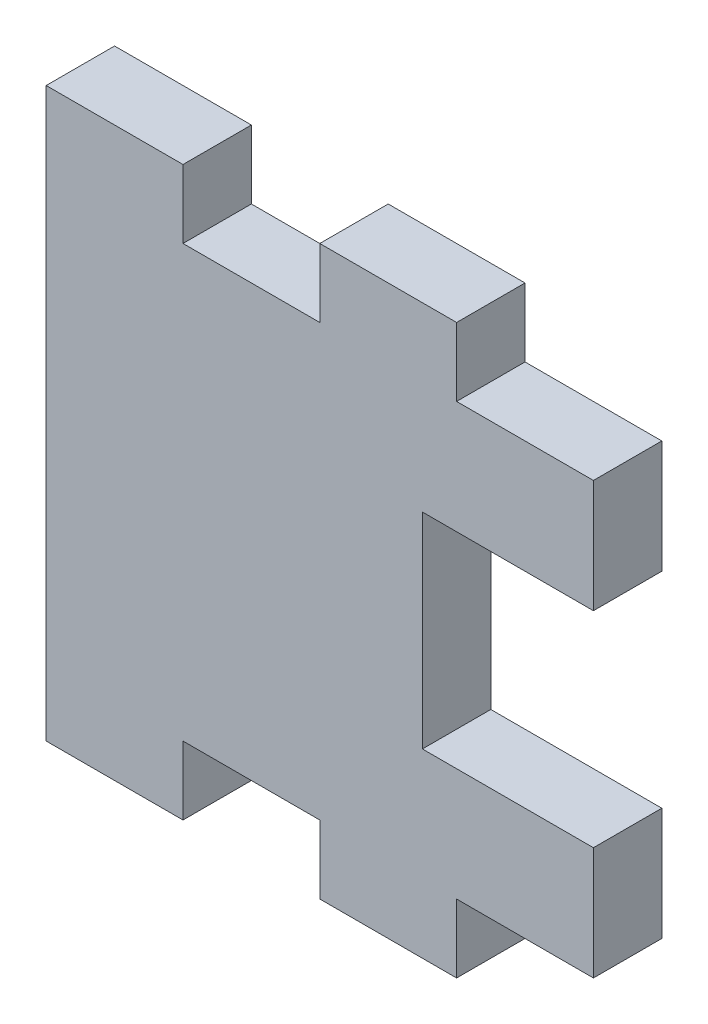
from build123d import *

# Parameters (mm, degrees)
BOSS_EXTRUDE1_DEPTH = 3.175


with BuildPart() as part:
    # Sketch1 → Boss-Extrude1 (new body)
    with BuildSketch(Plane.XY):
        Polygon((0, 0), (0, -3.175), (6.35, -3.175), (6.35, 0), (12.7, 0), (12.7, -3.175), (19.05, -3.175), (19.05, 0), (25.4, 0), (25.4, 5.2375), (17.4625, 5.2375), (17.4625, 14.7625), (25.4, 14.7625), (25.4, 20), (19.05, 20), (19.05, 23.175), (12.7, 23.175), (12.7, 20), (6.35, 20), (6.35, 23.175), (0, 23.175), (0, 20), (0, 10), align=None)
    extrude(amount=BOSS_EXTRUDE1_DEPTH)


solid = part.part
